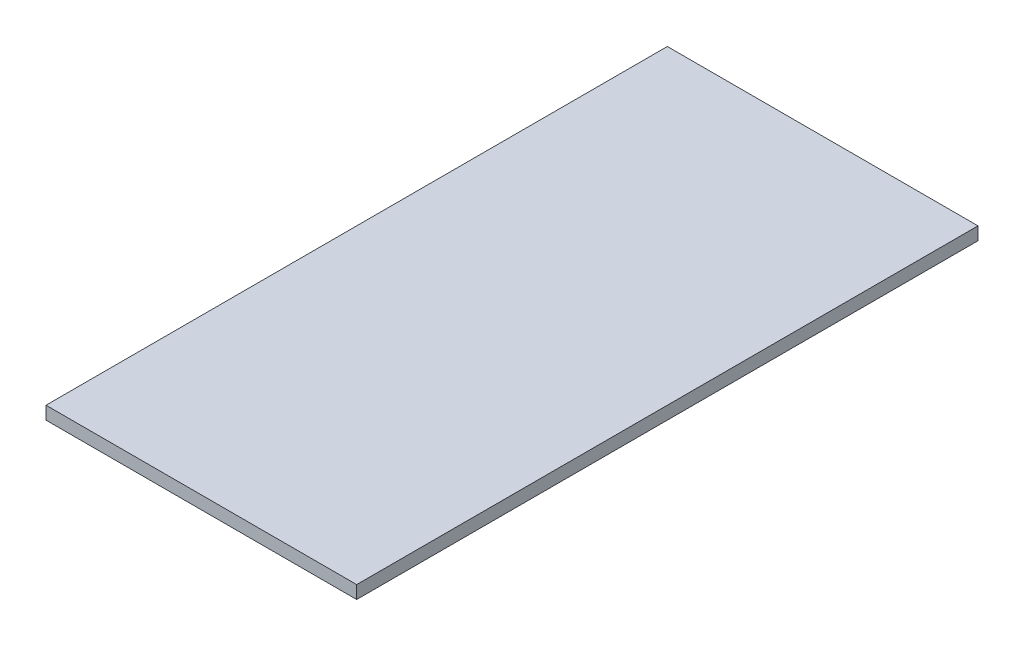
from build123d import *

# Parameters (mm, degrees)
SKETCH1_W           = 152.4
SKETCH1_H           = 304.8
BOSS_EXTRUDE1_DEPTH = 6.35


with BuildPart() as part:
    # Sketch1 → Boss-Extrude1 (new body)
    with BuildSketch(Plane(origin=(0, 0, 0), x_dir=(1, 0, 0), z_dir=(0, 1, 0))):
        Rectangle(SKETCH1_W, SKETCH1_H)
    extrude(amount=BOSS_EXTRUDE1_DEPTH)


solid = part.part
